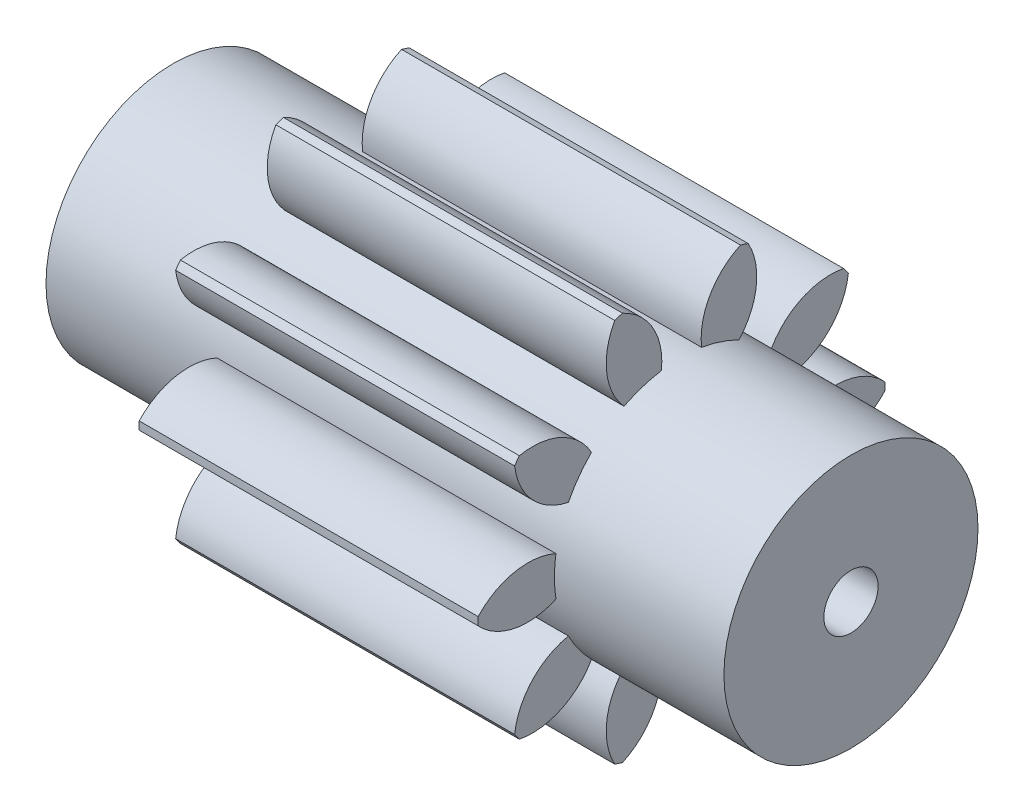
from build123d import *
from build123d.topology import SkipClean

# Parameters (mm, degrees)
BASPROSKE_W       = 5
BASPROSKE_H       = 3
TOOTHCUT_DEPTH    = 7.557438524
TEETHCUTS_COUNT   = 10
TEETHCUTS_ANGLE   = 324
HUBNEARBOTH_START = 2.5000254
HUBNEABOTSKE_R    = 1.874
HUBNEARBOTH_DEPTH = 2.5000254
HUBFARSKE_R       = 1.874
HUBFAR_DEPTH      = 2.5000254
BORSKE_R          = 0.4
BORE_DEPTH        = 10.0000508


with BuildPart() as part:
    # BasProSke → Base-Revolve (revolve)
    with BuildSketch(Plane(origin=(0, 0, 0), x_dir=(1, 0, 0), z_dir=(0, 1, 0)), mode=Mode.PRIVATE) as base_revolve_sk:
        with Locations((2.5, 1.5)):
            Rectangle(BASPROSKE_W, BASPROSKE_H)
    revolve(base_revolve_sk.sketch.rotate(Axis((-10, 0, 0), (1, 0, 0)), 180), axis=Axis((-10, 0, 0), (1, 0, 0)))

    # TooCutSke → ToothCut (cut, through all)
    with BuildSketch(Plane(origin=(0, 0, 0), x_dir=(0, 0, -1), z_dir=(1, 0, 0))):
        with BuildLine():
            ThreePointArc((0.296449938, 1.850403587), (0, 1.874), (-0.296449938, 1.850403587))
            ThreePointArc((-0.296449938, 1.850403587), (-0.428089565, 2.470295585), (-0.905889751, 2.886591228))
            ThreePointArc((-0.905889751, 2.886591228), (0, 3.0254), (0.905889751, 2.886591228))
            ThreePointArc((0.905889751, 2.886591228), (0.428089565, 2.470295585), (0.296449938, 1.850403587))
        make_face()
    toothcut = extrude(amount=TOOTHCUT_DEPTH, mode=Mode.SUBTRACT)

    # TeethCuts: ToothCut ×10 about axis
    teethcuts_axis = Axis((-10, 0, 0), (1, 0, 0))
    for i in range(1, TEETHCUTS_COUNT):
        add(toothcut.rotate(teethcuts_axis, i * TEETHCUTS_ANGLE / (TEETHCUTS_COUNT - 1)), mode=Mode.SUBTRACT)

    # HubNeaBotSke → HubNearBoth (add)
    with SkipClean():  # the faces are left unmerged after this step: merging them gives an invalid solid
        with BuildSketch(Plane.ZY.offset(HUBNEARBOTH_START)):
            Circle(HUBNEABOTSKE_R)
        extrude(amount=-HUBNEARBOTH_DEPTH)

    # HubFarSke → HubFar (add)
    with SkipClean():  # the faces are left unmerged after this step: merging them gives an invalid solid
        with BuildSketch(Plane(origin=(5, 0, 0), x_dir=(0, 0, -1), z_dir=(1, 0, 0))):
            with Locations(Location((0, 0, 0), (0, 0, 180))):
                Circle(HUBFARSKE_R)
        extrude(amount=HUBFAR_DEPTH)

    # BorSke → Bore (cut, symmetric)
    with SkipClean():  # the faces are left unmerged after this step: merging them gives an invalid solid
        with BuildSketch(Plane(origin=(0, 0, 0), x_dir=(0, 0, -1), z_dir=(1, 0, 0))):
            with Locations(Location((0, 0, 0), (0, 0, 180))):
                Circle(BORSKE_R)
        extrude(amount=BORE_DEPTH, both=True, mode=Mode.SUBTRACT)


solid = part.part
